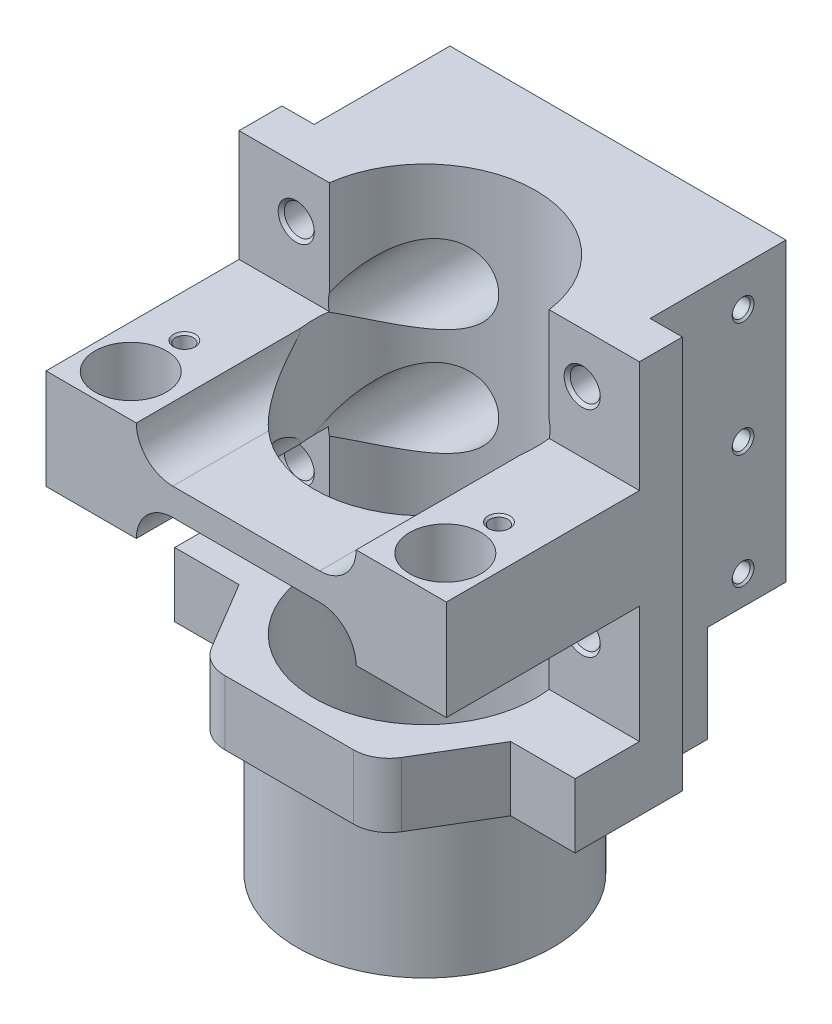
from build123d import *

# Parameters (mm, degrees)
BOSS_EXTRUDE1_DEPTH         = 55
BOSS_EXTRUDE2_START         = -15.6
SKETCH1_3_W                 = 28
SKETCH1_3_H                 = 27
BOSS_EXTRUDE2_DEPTH         = 14
BOSS_EXTRUDE3_DEPTH         = 9
SKETCH3_W                   = 11
SKETCH3_H                   = 12.2
CUT_EXTRUDE1_DEPTH          = 92.549167118
SKETCH4_R                   = 13
BOSS_EXTRUDE4_DEPTH         = 20
CUT_EXTRUDE2_START          = -3.5
SKETCH5_R                   = 15.5
CUT_EXTRUDE2_DEPTH          = 92.962034338
CUT_EXTRUDE5_REACH          = 97.462
CUT_EXTRUDE5_END_RADIUS     = 15.5
CUT_EXTRUDE3_DEPTH          = 11
CUT_EXTRUDE7_DEPTH          = 11
BOSS_EXTRUDE5_DEPTH         = 1
SKETCH8_R                   = 3
CUT_EXTRUDE4_DEPTH          = 96.462034393
CUT_EXTRUDE6_REACH          = 101.462
CUT_EXTRUDE6_START          = -4
SKETCH12_R                  = 5.5
M5_TAPPED_HOLE1_D           = 4.2
M5_TAPPED_HOLE1_DEPTH       = 15.6
M5_TAPPED_HOLE1_CSINK_D     = 5.05
M5_TAPPED_HOLE1_CSINK_ANGLE = 90
M5_TAPPED_HOLE1_TIP         = 1.2618073
M3_TAPPED_HOLE1_AT_2_COUNT  = 2
M3_TAPPED_HOLE1_AT_2_PITCH  = 16
M3_TAPPED_HOLE1_AT_3_COUNT  = 2
M3_TAPPED_HOLE1_AT_3_PITCH  = 32
SKETCH24_R                  = 4.15
CUT_EXTRUDE8_DEPTH          = 84.763715357
SKETCH24_3_R                = 5
SKETCH24_3_R_2              = 4.15
CUT_EXTRUDE9_DEPTH          = 12
M3_TAPPED_HOLE2_D           = 2.5
M3_TAPPED_HOLE2_CSINK_D     = 3.05
M3_TAPPED_HOLE2_CSINK_ANGLE = 90


with BuildPart() as part:
    # Sketch1 → Boss-Extrude1 (new body)
    with BuildSketch(Plane(origin=(0, 0, 0), x_dir=(1, 0, 0), z_dir=(0, 1, 0))):
        Polygon((0, 0), (-23.5, 0), (-23.5, -19), (-28, -19), (-28, -25), (0, -25), align=None)
        Polygon((23.5, 0), (0, 0), (0, -25), (28, -25), (28, -19), (23.5, -19), align=None)
    extrude(amount=-BOSS_EXTRUDE1_DEPTH)

    # Sketch1<3> → Boss-Extrude2 (add)
    with BuildSketch(Plane(origin=(0, 0, 0), x_dir=(1, 0, 0), z_dir=(0, 1, 0)).offset(BOSS_EXTRUDE2_START)):
        with Locations((-14, -38.5)):
            Rectangle(SKETCH1_3_W, SKETCH1_3_H)
        with Locations((14, -38.5)):
            Rectangle(SKETCH1_3_W, SKETCH1_3_H)
    extrude(amount=-BOSS_EXTRUDE2_DEPTH)

    # Sketch2 → Boss-Extrude3 (add)
    with BuildSketch(Plane.XZ.offset(55)):
        with BuildLine():
            Line((-28, 25), (-28, 34))
            Line((-28, 34), (-19, 34))
            Line((-19, 34), (-13.293580573, 43.562257962))
            ThreePointArc((-13.293580573, 43.562257962), (-11.468674765, 45.348062201), (-9, 46))
            Line((-9, 46), (9, 46))
            ThreePointArc((9, 46), (11.468674765, 45.348062201), (13.293580573, 43.562257962))
            Line((13.293580573, 43.562257962), (19, 34))
            Line((19, 34), (28, 34))
            Line((28, 34), (28, 25))
            Line((28, 25), (-28, 25))
        make_face()
    extrude(amount=-BOSS_EXTRUDE3_DEPTH)

    # Sketch3 → Cut-Extrude1 (cut, through all)
    with BuildSketch(Plane.ZY.offset(23.5)):
        with Locations((5.5, -48.9)):
            Rectangle(SKETCH3_W, SKETCH3_H)
    extrude(amount=-CUT_EXTRUDE1_DEPTH, mode=Mode.SUBTRACT)

    # Sketch4 → Boss-Extrude4 (add)
    with BuildSketch(Plane.XZ.offset(55)):
        with BuildLine():
            Line((8.025584091, 11), (-8.025584091, 11))
            ThreePointArc((-8.025584091, 11), (0, 44.9), (8.025584091, 11))
        make_face()
        with Locations(Location((0, 27, 0), (0, 0, 270))):
            Circle(SKETCH4_R, mode=Mode.SUBTRACT)
    extrude(amount=BOSS_EXTRUDE4_DEPTH)

    # Sketch5 → Cut-Extrude2 (cut, through all)
    with BuildSketch(Plane.XZ.offset(75).offset(CUT_EXTRUDE2_START)):
        with Locations(Location((0, 27, 0), (0, 0, 270))):
            Circle(SKETCH5_R)
    extrude(amount=-CUT_EXTRUDE2_DEPTH, mode=Mode.SUBTRACT)

    # Cut-Extrude5: up to this cylinder (the profile starts outside it)
    cut_extrude5_end = Plane(origin=(0, -22.6, 27), z_dir=(0, -1, 0)) * Cylinder(CUT_EXTRUDE5_END_RADIUS, 236.040322, mode=Mode.PRIVATE)
    # Sketch10 → Cut-Extrude5 (cut, up to the surface)
    with BuildSketch(Plane.XY.offset(52), mode=Mode.PRIVATE) as cut_extrude5_sk1:
        with BuildLine():
            Line((-10.270426149, -20.7), (10.270426149, -20.7))
            ThreePointArc((10.270426149, -20.7), (13.876670733, -19.206244584), (15.370426149, -15.6))
            Line((15.370426149, -15.6), (-15.370426149, -15.6))
            ThreePointArc((-15.370426149, -15.6), (-13.876670733, -19.206244584), (-10.270426149, -20.7))
        make_face()
    cut_extrude5_tool1 = extrude(cut_extrude5_sk1.sketch, amount=-CUT_EXTRUDE5_REACH, mode=Mode.PRIVATE) - cut_extrude5_end
    add(cut_extrude5_tool1.solids().sort_by_distance((0, -18.041839, 52))[0], mode=Mode.SUBTRACT)
    # Sketch10 → Cut-Extrude5 (cut, up to the surface)
    with BuildSketch(Plane.XY.offset(52), mode=Mode.PRIVATE) as cut_extrude5_sk2:
        with BuildLine():
            Line((15.370426149, -29.6), (-15.370426149, -29.6))
            ThreePointArc((-15.370426149, -29.6), (-13.876670733, -25.993755416), (-10.270426149, -24.5))
            Line((-10.270426149, -24.5), (10.270426149, -24.5))
            ThreePointArc((10.270426149, -24.5), (13.876670733, -25.993755416), (15.370426149, -29.6))
        make_face()
    cut_extrude5_tool2 = extrude(cut_extrude5_sk2.sketch, amount=-CUT_EXTRUDE5_REACH, mode=Mode.PRIVATE) - cut_extrude5_end
    add(cut_extrude5_tool2.solids().sort_by_distance((0, -27.158161, 52))[0], mode=Mode.SUBTRACT)

    # Sketch7 → Cut-Extrude3 (cut)
    with BuildSketch(Plane(origin=(0, 0, 0), x_dir=(-1, 0, 0), z_dir=(0, 0, -1))):
        with BuildLine():
            Line((5, -42.8), (5, -22))
            ThreePointArc((5, -22), (0, -17), (-5, -22))
            Line((-5, -22), (-5, -42.8))
            Line((-5, -42.8), (5, -42.8))
        make_face()
    extrude(amount=-CUT_EXTRUDE3_DEPTH, mode=Mode.SUBTRACT)

    # Sketch22 → Cut-Extrude7 (cut)
    with BuildSketch(Plane(origin=(0, 0, 0), x_dir=(-1, 0, 0), z_dir=(0, 0, -1))):
        Polygon((-22.136038969, -42.8), (-23.5, -41.436038969), (-23.5, -42.8), align=None)
        Polygon((-5, -40.163961031), (-7.636038969, -42.8), (-5, -42.8), align=None)
    cut_extrude7 = extrude(amount=-CUT_EXTRUDE7_DEPTH, mode=Mode.SUBTRACT)

    # Sketch22<3> → Boss-Extrude5 (add)
    with BuildSketch(Plane(origin=(0, 0, 0), x_dir=(-1, 0, 0), z_dir=(0, 0, -1))):
        Polygon((-7.636038969, -42.8), (-22.136038969, -42.8), (-17.136038969, -47.8), (-12.636038969, -47.8), align=None)
    boss_extrude5 = extrude(amount=-BOSS_EXTRUDE5_DEPTH)

    # Sketch8 → Cut-Extrude4 (cut, through all)
    with BuildSketch(Plane(origin=(0, 0, 0), x_dir=(-1, 0, 0), z_dir=(0, 0, -1))):
        with Locations((-10, -14.5)):
            Circle(SKETCH8_R)
        with Locations((10, -14.5)):
            Circle(SKETCH8_R)
        with Locations((-10, -29.5)):
            Circle(SKETCH8_R)
        with Locations((10, -29.5)):
            Circle(SKETCH8_R)
    extrude(amount=-CUT_EXTRUDE4_DEPTH, mode=Mode.SUBTRACT)

    # Sketch12 → Cut-Extrude6 (cut, up to next)
    with BuildSketch(Plane(origin=(0, 0, 0), x_dir=(-1, 0, 0), z_dir=(0, 0, -1)).offset(CUT_EXTRUDE6_START), mode=Mode.PRIVATE) as cut_extrude6_sk1:
        with Locations((-10, -14.5)):
            Circle(SKETCH12_R)
    cut_extrude6_tool1 = extrude(cut_extrude6_sk1.sketch, amount=-CUT_EXTRUDE6_REACH, mode=Mode.PRIVATE) & part.part
    # Sketch12 → Cut-Extrude6 (cut, up to next)
    with BuildSketch(Plane(origin=(0, 0, 0), x_dir=(-1, 0, 0), z_dir=(0, 0, -1)).offset(CUT_EXTRUDE6_START), mode=Mode.PRIVATE) as cut_extrude6_sk2:
        with Locations(Location((-10, -29.5, 0), (0, 0, 24.619977329))):
            Circle(SKETCH12_R)
    cut_extrude6_tool2 = extrude(cut_extrude6_sk2.sketch, amount=-CUT_EXTRUDE6_REACH, mode=Mode.PRIVATE) & part.part
    # Sketch12 → Cut-Extrude6 (cut, up to next)
    with BuildSketch(Plane(origin=(0, 0, 0), x_dir=(-1, 0, 0), z_dir=(0, 0, -1)).offset(CUT_EXTRUDE6_START), mode=Mode.PRIVATE) as cut_extrude6_sk3:
        with Locations((10, -14.5)):
            Circle(SKETCH12_R)
    cut_extrude6_tool3 = extrude(cut_extrude6_sk3.sketch, amount=-CUT_EXTRUDE6_REACH, mode=Mode.PRIVATE) & part.part
    # Sketch12 → Cut-Extrude6 (cut, up to next)
    with BuildSketch(Plane(origin=(0, 0, 0), x_dir=(-1, 0, 0), z_dir=(0, 0, -1)).offset(CUT_EXTRUDE6_START), mode=Mode.PRIVATE) as cut_extrude6_sk4:
        with Locations((10, -29.5)):
            Circle(SKETCH12_R)
    cut_extrude6_tool4 = extrude(cut_extrude6_sk4.sketch, amount=-CUT_EXTRUDE6_REACH, mode=Mode.PRIVATE) & part.part
    add(cut_extrude6_tool1.solids().sort_by_distance((10, -14.5, 4))[0], mode=Mode.SUBTRACT)
    add(cut_extrude6_tool2.solids().sort_by_distance((10, -29.5, 4))[0], mode=Mode.SUBTRACT)
    add(cut_extrude6_tool3.solids().sort_by_distance((-10, -14.5, 4))[0], mode=Mode.SUBTRACT)
    add(cut_extrude6_tool4.solids().sort_by_distance((-10, -29.5, 4))[0], mode=Mode.SUBTRACT)

    # M5 Tapped Hole1
    with Locations(Plane.XY.offset(25)):
        with Locations((-20, -7), (20, -7), (20, -37), (-20, -36.287259234)):
            CounterSinkHole(M5_TAPPED_HOLE1_D / 2, M5_TAPPED_HOLE1_CSINK_D / 2, depth=M5_TAPPED_HOLE1_DEPTH, counter_sink_angle=M5_TAPPED_HOLE1_CSINK_ANGLE)
            with Locations((0, 0, -(M5_TAPPED_HOLE1_DEPTH + M5_TAPPED_HOLE1_TIP / 2))):  # 118° drill point
                Cone(0, M5_TAPPED_HOLE1_D / 2, M5_TAPPED_HOLE1_TIP, mode=Mode.SUBTRACT)

    # Sketch20 → M3 Tapped Hole1 (revolve, cut)
    with BuildSketch(Plane(origin=(23.5, -5.4, 6), x_dir=(0, 0, -1), z_dir=(0, 1, 0))):
        Polygon((0, 0), (0, 7.751075774), (1.25, 7), (1.25, 0.275), (1.525, 0), align=None)
    m3_tapped_hole1 = revolve(axis=Axis((29.85, -5.4, 6), (-1, 0, 0)), mode=Mode.SUBTRACT)

    # M3 Tapped Hole1 at 2: M3 Tapped Hole1 ×2
    with Locations(*[(0, -i * M3_TAPPED_HOLE1_AT_2_PITCH, 0) for i in range(1, M3_TAPPED_HOLE1_AT_2_COUNT)]):
        add(m3_tapped_hole1, mode=Mode.SUBTRACT)

    # M3 Tapped Hole1 at 3: M3 Tapped Hole1 ×2
    with Locations(*[(0, -i * M3_TAPPED_HOLE1_AT_3_PITCH, 0) for i in range(1, M3_TAPPED_HOLE1_AT_3_COUNT)]):
        add(m3_tapped_hole1, mode=Mode.SUBTRACT)

    # Mirror1: M3 Tapped Hole1 across plane
    add(m3_tapped_hole1.mirror(Plane(origin=(0, 0, 0), x_dir=(0, 0, 1), z_dir=(1, 0, 0))), mode=Mode.SUBTRACT)

    # Mirror1 copy 1 sketch → Mirror1 copy 1 (revolve, cut)
    with BuildSketch(Plane(origin=(-23.5, -21.4, 6), x_dir=(0, 0, -1), z_dir=(0, 1, 0))):
        Polygon((0, 0), (0, -7.751075774), (1.25, -7), (1.25, -0.275), (1.525, 0), align=None)
    revolve(axis=Axis((-29.85, -21.4, 6), (-1, 0, 0)), mode=Mode.SUBTRACT)

    # Mirror1 copy 2 sketch → Mirror1 copy 2 (revolve, cut)
    with BuildSketch(Plane(origin=(-23.5, -37.4, 6), x_dir=(0, 0, -1), z_dir=(0, 1, 0))):
        Polygon((0, 0), (0, -7.751075774), (1.25, -7), (1.25, -0.275), (1.525, 0), align=None)
    revolve(axis=Axis((-29.85, -37.4, 6), (-1, 0, 0)), mode=Mode.SUBTRACT)

    # Mirror3: Cut-Extrude7, Boss-Extrude5 across plane
    add(cut_extrude7.mirror(Plane(origin=(0, 0, 0), x_dir=(0, 0, 1), z_dir=(1, 0, 0))), mode=Mode.SUBTRACT)
    add(boss_extrude5.mirror(Plane(origin=(0, 0, 0), x_dir=(0, 0, 1), z_dir=(1, 0, 0))))

    # Sketch24 → Cut-Extrude8 (cut, symmetric)
    with BuildSketch(Plane(origin=(0, -15.6, 0), x_dir=(1, 0, 0), z_dir=(0, 1, 0))):
        with Locations(Location((-22, -46.15, 0), (0, 0, 270))):
            Circle(SKETCH24_R)
    cut_extrude8 = extrude(amount=CUT_EXTRUDE8_DEPTH, both=True, mode=Mode.SUBTRACT)

    # Sketch24<3> → Cut-Extrude9 (cut)
    with BuildSketch(Plane(origin=(0, -15.6, 0), x_dir=(1, 0, 0), z_dir=(0, 1, 0))):
        with Locations(Location((-22, -46.15, 0), (0, 0, 270))):
            Circle(SKETCH24_3_R)
        with Locations(Location((-22, -46.15, 0), (0, 0, 270))):
            Circle(SKETCH24_3_R_2, mode=Mode.SUBTRACT)
    cut_extrude9 = extrude(amount=-CUT_EXTRUDE9_DEPTH, mode=Mode.SUBTRACT)

    # Mirror4: Cut-Extrude8, Cut-Extrude9 across plane
    add(cut_extrude8.mirror(Plane(origin=(0, 0, 0), x_dir=(0, 0, 1), z_dir=(1, 0, 0))), mode=Mode.SUBTRACT)
    add(cut_extrude9.mirror(Plane(origin=(0, 0, 0), x_dir=(0, 0, 1), z_dir=(1, 0, 0))), mode=Mode.SUBTRACT)

    # M3 Tapped Hole2 (through all)
    with Locations(Plane(origin=(0, -15.6, 0), x_dir=(1, 0, 0), z_dir=(0, 1, 0))):
        with Locations((22, -38.65), (-22, -38.65)):
            CounterSinkHole(M3_TAPPED_HOLE2_D / 2, M3_TAPPED_HOLE2_CSINK_D / 2, counter_sink_angle=M3_TAPPED_HOLE2_CSINK_ANGLE)


solid = part.part
